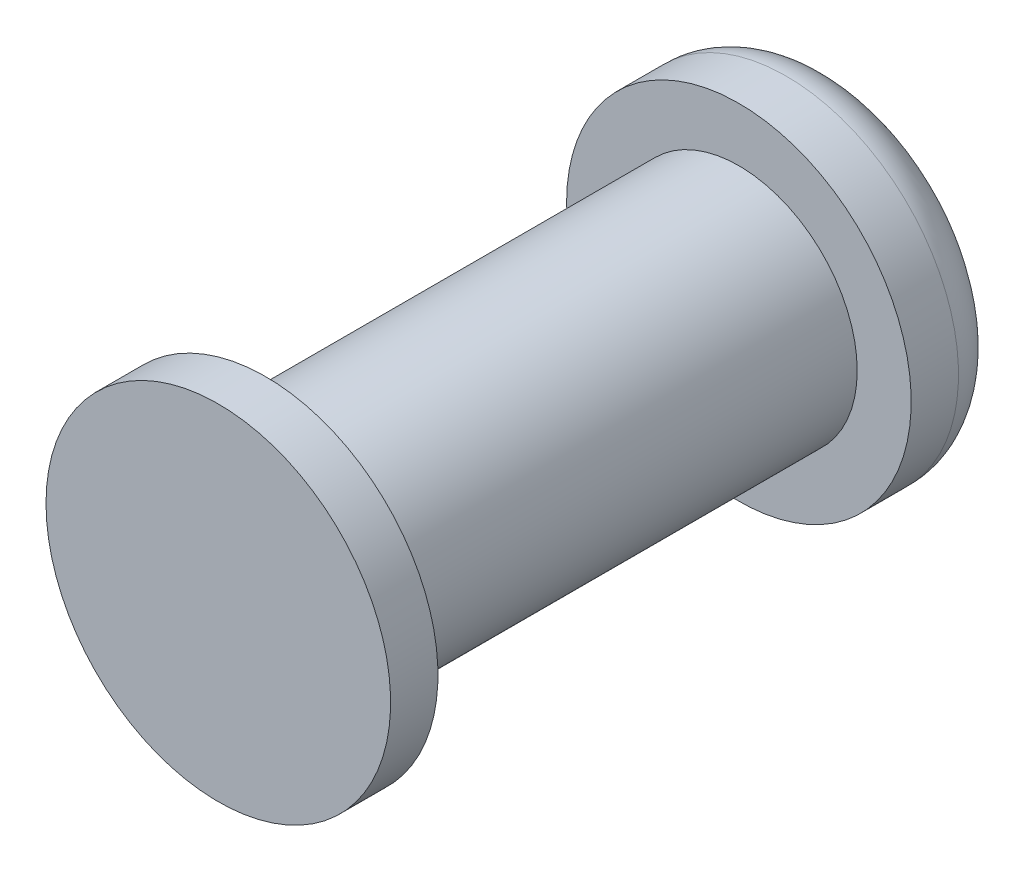
from build123d import *

# Parameters (mm, degrees)
SKETCH1_R           = 0.635
BOSS_EXTRUDE1_DEPTH = 2.794
SKETCH3_R           = 0.924810793
BOSS_EXTRUDE2_DEPTH = 0.508
FILLET2_R           = 0.254
SKETCH4_W           = 0.289810793
SKETCH4_H           = 0.254


with BuildPart() as part:
    # Sketch1 → Boss-Extrude1 (new body)
    with BuildSketch(Plane.XY):
        Circle(SKETCH1_R)
    extrude(amount=BOSS_EXTRUDE1_DEPTH)

    # Sketch3 → Boss-Extrude2 (add)
    with BuildSketch(Plane(origin=(0, 0, 0), x_dir=(-1, 0, 0), z_dir=(0, 0, -1))):
        Circle(SKETCH3_R)
    extrude(amount=BOSS_EXTRUDE2_DEPTH)

    # Fillet2
    fillet2_edges = [part.edges().sort_by_distance(p)[0] for p in [
        (0.924810793, 0, -0.508),
    ]]
    fillet(fillet2_edges, radius=FILLET2_R)

    # Sketch4 → Revolve2 (revolve)
    with BuildSketch(Plane(origin=(0, 0, 0), x_dir=(1, 0, 0), z_dir=(0, 1, 0))):
        with Locations((0.779905397, -2.667)):
            Rectangle(SKETCH4_W, SKETCH4_H)
    revolve(axis=Axis((0, 0, -1.170141318), (0, 0, 1)))


solid = part.part
